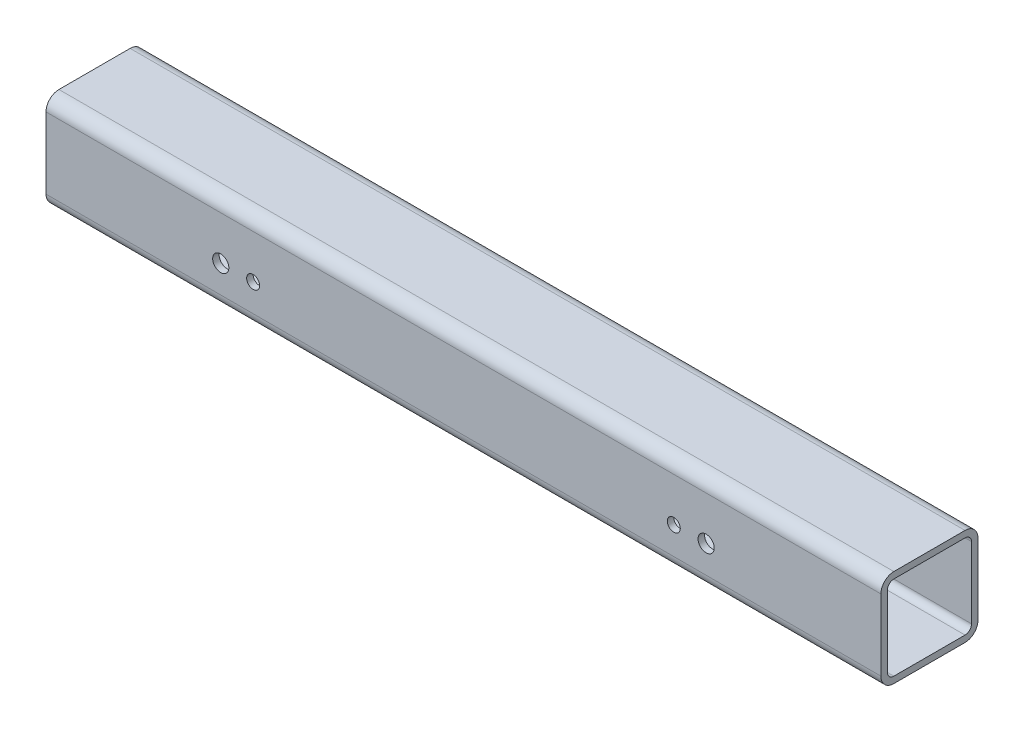
from build123d import *

# Parameters (mm, degrees)
EXTRUDE_1_DEPTH          = 129
CUT_EXTRUDE_1_DEPTH      = 131.732551417
CUT_EXTRUDE_1_DEPTH_BACK = 131.732551417
SKETCH_2_R               = 2.5
SKETCH_2_R_2             = 2


with BuildPart() as part:
    # 草图1 → 凸台-拉伸1 (new, symmetric)
    with BuildSketch(Plane(origin=(0, 0, 0), x_dir=(0, 0, -1), z_dir=(1, 0, 0))):
        with BuildLine():
            Line((-11, -15), (11, -15))
            ThreePointArc((11, -15), (13.828427125, -13.828427125), (15, -11))
            Line((15, -11), (15, 11))
            ThreePointArc((15, 11), (13.828427125, 13.828427125), (11, 15))
            Line((11, 15), (-11, 15))
            ThreePointArc((-11, 15), (-13.828427125, 13.828427125), (-15, 11))
            Line((-15, 11), (-15, -11))
            ThreePointArc((-15, -11), (-13.828427125, -13.828427125), (-11, -15))
        make_face()
        with BuildLine():
            Line((-11, -13), (11, -13))
            ThreePointArc((11, -13), (12.414213562, -12.414213562), (13, -11))
            Line((13, -11), (13, 11))
            ThreePointArc((13, 11), (12.414213562, 12.414213562), (11, 13))
            Line((11, 13), (-11, 13))
            ThreePointArc((-11, 13), (-12.414213562, 12.414213562), (-13, 11))
            Line((-13, 11), (-13, -11))
            ThreePointArc((-13, -11), (-12.414213562, -12.414213562), (-11, -13))
        make_face(mode=Mode.SUBTRACT)
    extrude(amount=EXTRUDE_1_DEPTH, both=True)

    # 草图2 → 切除-拉伸1 (cut, two sides: drawn at the far end of the back side and taken through both)
    with BuildSketch(Plane.XY.offset(-CUT_EXTRUDE_1_DEPTH_BACK)):
        with Locations((-75, -2.5)):
            Circle(SKETCH_2_R)
        with Locations(Location((75, -2.5, 0), (0, 0, 90))):
            Circle(SKETCH_2_R)
        with Locations((-65, -2.5)):
            Circle(SKETCH_2_R_2)
        with Locations(Location((65, -2.5, 0), (0, 0, 90))):
            Circle(SKETCH_2_R_2)
    extrude(amount=CUT_EXTRUDE_1_DEPTH + CUT_EXTRUDE_1_DEPTH_BACK, mode=Mode.SUBTRACT)


solid = part.part
